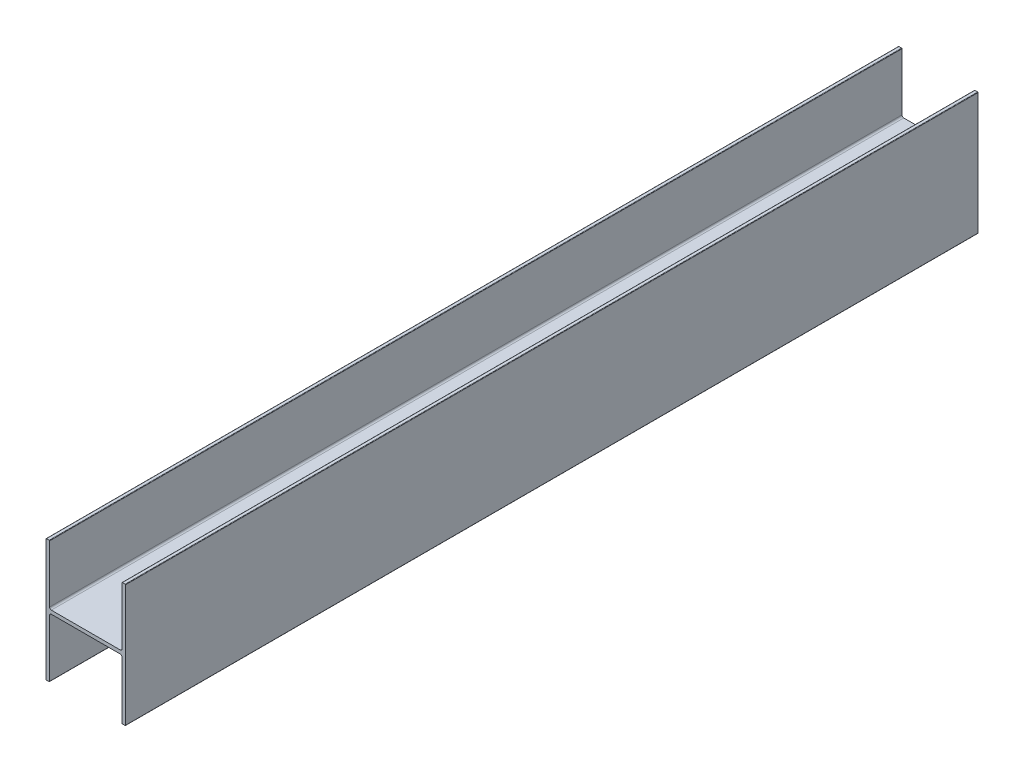
from build123d import *

# Parameters (mm, degrees)
BOSS_EXTRUDE1_DEPTH      = 152.4
BOSS_EXTRUDE1_DEPTH_BACK = 152.4
FILLET1_R                = 0.635
FILLET2_R                = 0.15875


with BuildPart() as part:
    # Sketch3 → Boss-Extrude1 (new, two sides: drawn at the far end of the back side and taken through both)
    with BuildSketch(Plane.XY.offset(-BOSS_EXTRUDE1_DEPTH_BACK)):
        Polygon((14.224, -21.8948), (14.224, 21.8948), (12.954, 21.8948), (12.954, 0.635), (-12.954, 0.635), (-12.954, 21.8948), (-14.224, 21.8948), (-14.224, -21.8948), (-12.954, -21.8948), (-12.954, -0.635), (12.954, -0.635), (12.954, -21.8948), align=None)
    extrude(amount=BOSS_EXTRUDE1_DEPTH + BOSS_EXTRUDE1_DEPTH_BACK)

    # Fillet1
    fillet1_edges = [part.edges().sort_by_distance(p)[0] for p in [
        (12.954, -0.635, 0),
        (-12.954, -0.635, 0),
        (-12.954, 0.635, 0),
        (12.954, 0.635, 0),
    ]]
    fillet(fillet1_edges, radius=FILLET1_R)

    # Fillet2
    fillet2_edges = [part.edges().sort_by_distance(p)[0] for p in [
        (12.954, -21.8948, 0),
        (-12.954, -21.8948, 0),
        (-14.224, -21.8948, 0),
        (-14.224, 21.8948, 0),
        (-12.954, 21.8948, 0),
        (12.954, 21.8948, 0),
        (14.224, 21.8948, 0),
        (14.224, -21.8948, 0),
    ]]
    fillet(fillet2_edges, radius=FILLET2_R)


solid = part.part
